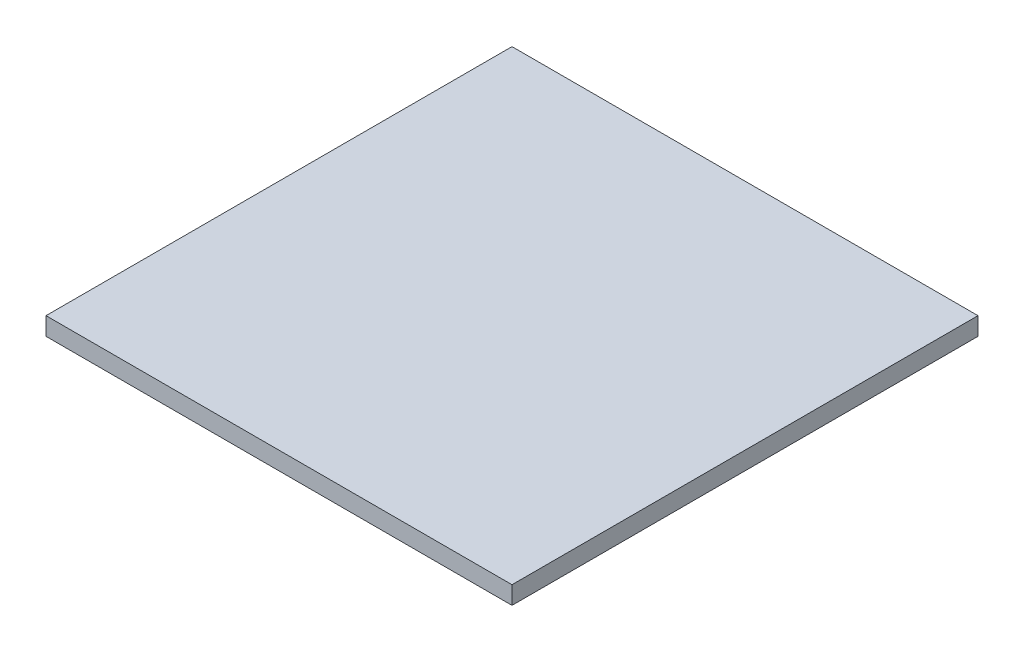
from build123d import *

# Parameters (mm, degrees)
SKETCH1_W           = 8320
SKETCH1_H           = 8320
BOSS_EXTRUDE1_DEPTH = 320


with BuildPart() as part:
    # Sketch1 → Boss-Extrude1 (new body)
    with BuildSketch(Plane(origin=(0, 0, 0), x_dir=(1, 0, 0), z_dir=(0, 1, 0))):
        Rectangle(SKETCH1_W, SKETCH1_H)
    extrude(amount=BOSS_EXTRUDE1_DEPTH)


solid = part.part
